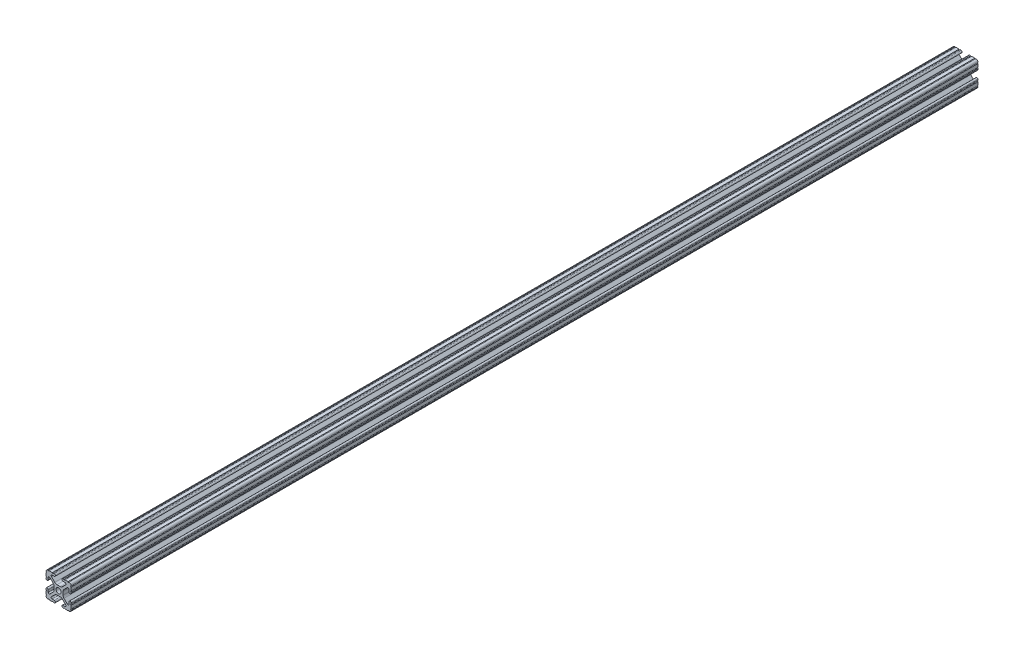
from build123d import *

# Parameters (mm, degrees)
SKETCH1_R           = 2.6035
BOSS_EXTRUDE1_DEPTH = 914.4


with BuildPart() as part:
    # Sketch1 → Boss-Extrude1 (new body)
    with BuildSketch(Plane.XY):
        with BuildLine():
            Line((-12.7, -6.3330836), (-12.7, -9.5504))
            ThreePointArc((-12.7, -9.5504), (-12.192000006, -10.058323491), (-12.699846982, -10.566399977))
            ThreePointArc((-12.699846982, -10.566399977), (-12.082522516, -12.082522516), (-10.566399977, -12.699846982))
            ThreePointArc((-10.566399977, -12.699846982), (-10.058323491, -12.192000006), (-9.5504, -12.7))
            Line((-9.5504, -12.7), (-6.3330836, -12.7))
            ThreePointArc((-6.3330836, -12.7), (-5.8250836, -12.192), (-5.3170836, -12.7))
            Line((-5.3170836, -12.7), (-4.343399971, -12.7))
            ThreePointArc((-4.343399971, -12.7), (-3.238499971, -11.5951), (-4.343399971, -10.4902))
            Line((-4.343399971, -10.4902), (-6.474794456, -10.4902))
            ThreePointArc((-6.474794456, -10.4902), (-7.413456061, -9.863006367), (-7.193214945, -8.75577951))
            Line((-7.193214945, -8.75577951), (-3.863171405, -5.42573597))
            ThreePointArc((-3.863171405, -5.42573597), (-2.833127272, -4.737482484), (-1.618107374, -4.4958))
            Line((-1.618107374, -4.4958), (1.618107374, -4.4958))
            ThreePointArc((1.618107374, -4.4958), (2.833127272, -4.737482484), (3.863171405, -5.42573597))
            Line((3.863171405, -5.42573597), (7.193214945, -8.75577951))
            ThreePointArc((7.193214945, -8.75577951), (7.413456061, -9.863006367), (6.474794456, -10.4902))
            Line((6.474794456, -10.4902), (4.3434, -10.4902))
            ThreePointArc((4.3434, -10.4902), (3.2385, -11.5951), (4.3434, -12.7))
            Line((4.3434, -12.7), (5.3170836, -12.7))
            ThreePointArc((5.3170836, -12.7), (5.8250836, -12.192), (6.3330836, -12.7))
            Line((6.3330836, -12.7), (9.5504, -12.7))
            ThreePointArc((9.5504, -12.7), (10.058323491, -12.192000006), (10.566399977, -12.699846982))
            ThreePointArc((10.566399977, -12.699846982), (12.082522516, -12.082522516), (12.699846982, -10.566399977))
            ThreePointArc((12.699846982, -10.566399977), (12.192000006, -10.058323491), (12.7, -9.5504))
            Line((12.7, -9.5504), (12.7, -6.3330836))
            ThreePointArc((12.7, -6.3330836), (12.192, -5.8250836), (12.7, -5.3170836))
            Line((12.7, -5.3170836), (12.7, -4.343399971))
            ThreePointArc((12.7, -4.343399971), (11.5951, -3.238499971), (10.4902, -4.343399971))
            Line((10.4902, -4.343399971), (10.4902, -6.474794456))
            ThreePointArc((10.4902, -6.474794456), (9.863006367, -7.413456061), (8.75577951, -7.193214945))
            Line((8.75577951, -7.193214945), (5.42573597, -3.863171405))
            ThreePointArc((5.42573597, -3.863171405), (4.737482484, -2.833127272), (4.4958, -1.618107374))
            Line((4.4958, -1.618107374), (4.4958, 1.618107374))
            ThreePointArc((4.4958, 1.618107374), (4.737482484, 2.833127272), (5.42573597, 3.863171405))
            Line((5.42573597, 3.863171405), (8.75577951, 7.193214945))
            ThreePointArc((8.75577951, 7.193214945), (9.863006367, 7.413456061), (10.4902, 6.474794456))
            Line((10.4902, 6.474794456), (10.4902, 4.3434))
            ThreePointArc((10.4902, 4.3434), (11.5951, 3.2385), (12.7, 4.3434))
            Line((12.7, 4.3434), (12.7, 5.3170836))
            ThreePointArc((12.7, 5.3170836), (12.192, 5.8250836), (12.7, 6.3330836))
            Line((12.7, 6.3330836), (12.7, 9.5504))
            ThreePointArc((12.7, 9.5504), (12.192000006, 10.058323491), (12.699846982, 10.566399977))
            ThreePointArc((12.699846982, 10.566399977), (12.082522516, 12.082522516), (10.566399977, 12.699846982))
            ThreePointArc((10.566399977, 12.699846982), (10.058323491, 12.192000006), (9.5504, 12.7))
            Line((9.5504, 12.7), (6.3330836, 12.7))
            ThreePointArc((6.3330836, 12.7), (5.8250836, 12.192), (5.3170836, 12.7))
            Line((5.3170836, 12.7), (4.343399971, 12.7))
            ThreePointArc((4.343399971, 12.7), (3.238499971, 11.5951), (4.343399971, 10.4902))
            Line((4.343399971, 10.4902), (6.474794456, 10.4902))
            ThreePointArc((6.474794456, 10.4902), (7.413456061, 9.863006367), (7.193214945, 8.75577951))
            Line((7.193214945, 8.75577951), (3.863171405, 5.42573597))
            ThreePointArc((3.863171405, 5.42573597), (2.833127272, 4.737482484), (1.618107374, 4.4958))
            Line((1.618107374, 4.4958), (-1.618107374, 4.4958))
            ThreePointArc((-1.618107374, 4.4958), (-2.833127272, 4.737482484), (-3.863171405, 5.42573597))
            Line((-3.863171405, 5.42573597), (-7.193214945, 8.75577951))
            ThreePointArc((-7.193214945, 8.75577951), (-7.413456061, 9.863006367), (-6.474794456, 10.4902))
            Line((-6.474794456, 10.4902), (-4.3434, 10.4902))
            ThreePointArc((-4.3434, 10.4902), (-3.2385, 11.5951), (-4.3434, 12.7))
            Line((-4.3434, 12.7), (-5.3170836, 12.7))
            ThreePointArc((-5.3170836, 12.7), (-5.8250836, 12.192), (-6.3330836, 12.7))
            Line((-6.3330836, 12.7), (-9.5504, 12.7))
            ThreePointArc((-9.5504, 12.7), (-10.058323491, 12.192000006), (-10.566399977, 12.699846982))
            ThreePointArc((-10.566399977, 12.699846982), (-12.082522516, 12.082522516), (-12.699846982, 10.566399977))
            ThreePointArc((-12.699846982, 10.566399977), (-12.192000006, 10.058323491), (-12.7, 9.5504))
            Line((-12.7, 9.5504), (-12.7, 6.3330836))
            ThreePointArc((-12.7, 6.3330836), (-12.192, 5.8250836), (-12.7, 5.3170836))
            Line((-12.7, 5.3170836), (-12.7, 4.343399971))
            ThreePointArc((-12.7, 4.343399971), (-11.5951, 3.238499971), (-10.4902, 4.343399971))
            Line((-10.4902, 4.343399971), (-10.4902, 6.474794456))
            ThreePointArc((-10.4902, 6.474794456), (-9.863006367, 7.413456061), (-8.75577951, 7.193214945))
            Line((-8.75577951, 7.193214945), (-5.42573597, 3.863171405))
            ThreePointArc((-5.42573597, 3.863171405), (-4.737482484, 2.833127272), (-4.4958, 1.618107374))
            Line((-4.4958, 1.618107374), (-4.4958, -1.618107374))
            ThreePointArc((-4.4958, -1.618107374), (-4.737482484, -2.833127272), (-5.42573597, -3.863171405))
            Line((-5.42573597, -3.863171405), (-8.75577951, -7.193214945))
            ThreePointArc((-8.75577951, -7.193214945), (-9.863006367, -7.413456061), (-10.4902, -6.474794456))
            Line((-10.4902, -6.474794456), (-10.4902, -4.3434))
            ThreePointArc((-10.4902, -4.3434), (-11.5951, -3.2385), (-12.7, -4.3434))
            Line((-12.7, -4.3434), (-12.7, -5.3170836))
            ThreePointArc((-12.7, -5.3170836), (-12.192, -5.8250836), (-12.7, -6.3330836))
        make_face()
        with Locations(Location((0, 0, 0), (0, 0, 180))):
            Circle(SKETCH1_R, mode=Mode.SUBTRACT)
    extrude(amount=-BOSS_EXTRUDE1_DEPTH)


solid = part.part
